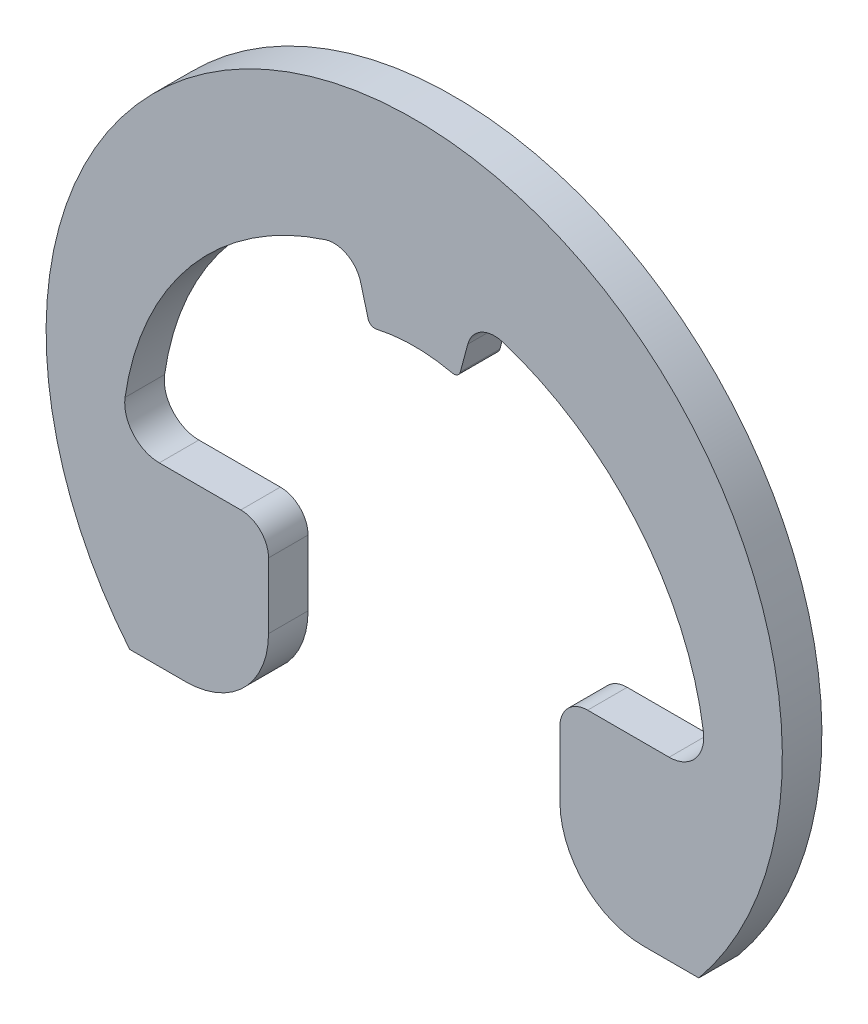
from build123d import *

# Parameters (mm, degrees)
SKETCH3_W               = 8.375
SKETCH3_H               = 0.9
CUT_EXTRUDE1_DEPTH      = 12.852584106
CUT_EXTRUDE1_DEPTH_BACK = 12.852584106
SKETCH4_OUTSIDE_W       = 23.492
SKETCH4_OUTSIDE_H       = 23.492
FILLET1_R               = 0.63
FILLET2_R               = 0.7875
FILLET3_R               = 1.89
FILLET4_R               = 0.1575


with BuildPart() as part:
    # Sketch3 → Revolve1 (revolve)
    with BuildSketch(Plane(origin=(0, 0, 0), x_dir=(1, 0, 0), z_dir=(0, 1, 0))):
        with Locations((-4.1875, 0)):
            Rectangle(SKETCH3_W, SKETCH3_H)
    revolve(axis=Axis((0, 0, -0.45), (0, 0, 1)))

    # Sketch4 outside → Cut-Extrude1 (cut, two sides: drawn at the far end of the back side and taken through both)
    with BuildSketch(Plane.XY.offset(-CUT_EXTRUDE1_DEPTH_BACK)):
        Rectangle(SKETCH4_OUTSIDE_W, SKETCH4_OUTSIDE_H)
        with BuildLine():
            Line((-3.315, -2.054452482), (-3.315, -5.3125))
            Line((-3.315, -5.3125), (-6.474408757, -5.3125))
            ThreePointArc((-6.474408757, -5.3125), (0, 8.375), (6.474408757, -5.3125))
            Line((6.474408757, -5.3125), (3.315, -5.3125))
            Line((3.315, -5.3125), (3.315, -2.054452482))
            Line((3.315, -2.054452482), (3.315, -1.3))
            Line((3.315, -1.3), (3.676955262, -1.3))
            Line((3.676955262, -1.3), (6.64647189, -1.3))
            ThreePointArc((6.64647189, -1.3), (5.150270007, 2.854307126), (1.381111973, 5.154380056))
            Line((1.381111973, 5.154380056), (1.009394276, 3.767110723))
            ThreePointArc((1.009394276, 3.767110723), (0, 3.9), (-1.009394276, 3.767110723))
            Line((-1.009394276, 3.767110723), (-1.381111973, 5.154380056))
            ThreePointArc((-1.381111973, 5.154380056), (-5.150270007, 2.854307126), (-6.64647189, -1.3))
            Line((-6.64647189, -1.3), (-3.676955262, -1.3))
            Line((-3.676955262, -1.3), (-3.315, -1.3))
            Line((-3.315, -1.3), (-3.315, -2.054452482))
        make_face(mode=Mode.SUBTRACT)
    extrude(amount=CUT_EXTRUDE1_DEPTH + CUT_EXTRUDE1_DEPTH_BACK, mode=Mode.SUBTRACT)

    # Fillet1
    fillet1_edges = [part.edges().sort_by_distance(p)[0] for p in [
        (3.315, -1.3, 0),
        (1.381111973, 5.154380056, 0),
        (-1.381111973, 5.154380056, 0),
        (-3.315, -1.3, 0),
    ]]
    fillet(fillet1_edges, radius=FILLET1_R)

    # Fillet2
    fillet2_edges = [part.edges().sort_by_distance(p)[0] for p in [
        (6.64647189, -1.3, 0),
        (-6.64647189, -1.3, 0),
    ]]
    fillet(fillet2_edges, radius=FILLET2_R)

    # Fillet3
    fillet3_edges = [part.edges().sort_by_distance(p)[0] for p in [
        (3.315, -5.3125, 0),
        (-3.315, -5.3125, 0),
    ]]
    fillet(fillet3_edges, radius=FILLET3_R)

    # Fillet4
    fillet4_edges = [part.edges().sort_by_distance(p)[0] for p in [
        (1.009394276, 3.767110723, 0),
        (-1.009394276, 3.767110723, 0),
    ]]
    fillet(fillet4_edges, radius=FILLET4_R)


solid = part.part
